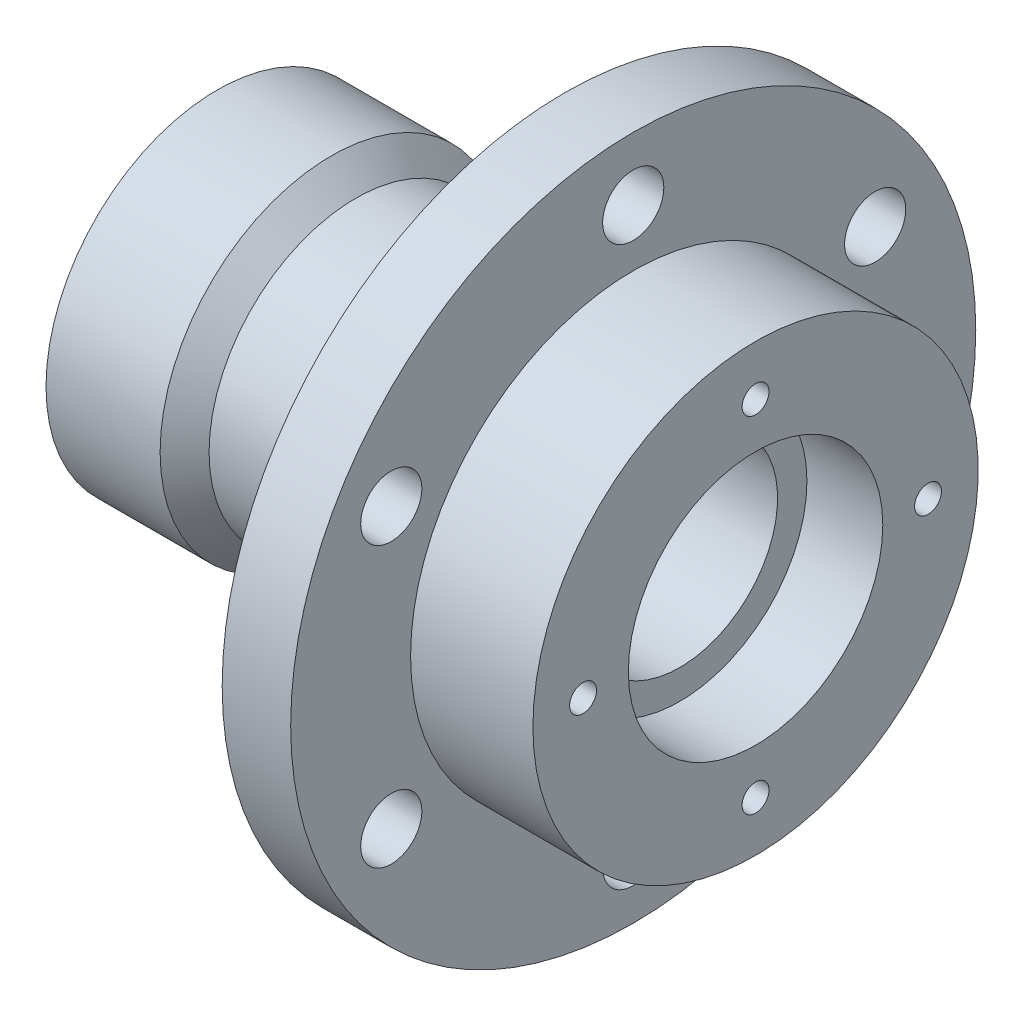
from build123d import *

# Parameters (mm, degrees)
FORO_12_5_12_5_1_D          = 12.5
RIPETIZIONECIRCOLARE1_COUNT = 6
RIPETIZIONECIRCOLARE2_COUNT = 4


with BuildPart() as part:
    # Schizzo1 → Rivoluzione1 (revolve)
    with BuildSketch(Plane.XY, mode=Mode.PRIVATE) as rivoluzione1_sk:
        Polygon((0, 35), (0, 23.5), (2, 23.5), (2, 24.75), (3.85, 24.75), (3.85, 23.5), (17.85, 23.5), (17.85, 20), (94.5, 20), (94.5, 26), (110, 26), (110, 45.5), (85, 45.5), (85, 70), (71, 70), (71, 30), (28.317889407, 30), (23.317889407, 35), align=None)
    revolve(rivoluzione1_sk.sketch.rotate(Axis((-28.748065329, 0, 0), (1, 0, 0)), 90), axis=Axis((-28.748065329, 0, 0), (1, 0, 0)))

    # Foro Ø12.5 (12.5)-1 (through all)
    with Locations(Plane.ZY.offset(-71)):
        with Locations((0, 57.09)):
            foro_12_5_12_5_1 = Hole(FORO_12_5_12_5_1_D / 2)

    # RipetizioneCircolare1: Foro Ø12.5 (12.5)-1 ×6 about axis
    ripetizionecircolare1_axis = Axis((0, 0, 0), (1, 0, 0))
    for i in range(1, RIPETIZIONECIRCOLARE1_COUNT):
        add(foro_12_5_12_5_1.rotate(ripetizionecircolare1_axis, i * 360 / RIPETIZIONECIRCOLARE1_COUNT), mode=Mode.SUBTRACT)

    # Schizzo7 → Foro per Vite M5-1 (revolve, cut)
    with BuildSketch(Plane(origin=(110, 35.25, 0), x_dir=(0, 0, -1), z_dir=(0, 1, 0))):
        Polygon((0, 0), (0, 13.652366702), (2.75, 12), (2.75, 0), align=None)
    foro_per_vite_m5_1 = revolve(axis=Axis((116.35, 35.25, 0), (-1, 0, 0)), mode=Mode.SUBTRACT)

    # RipetizioneCircolare2: Foro per Vite M5-1 ×4 about axis
    ripetizionecircolare2_axis = Axis((0, 0, 0), (1, 0, 0))
    for i in range(1, RIPETIZIONECIRCOLARE2_COUNT):
        add(foro_per_vite_m5_1.rotate(ripetizionecircolare2_axis, i * 360 / RIPETIZIONECIRCOLARE2_COUNT), mode=Mode.SUBTRACT)


solid = part.part
